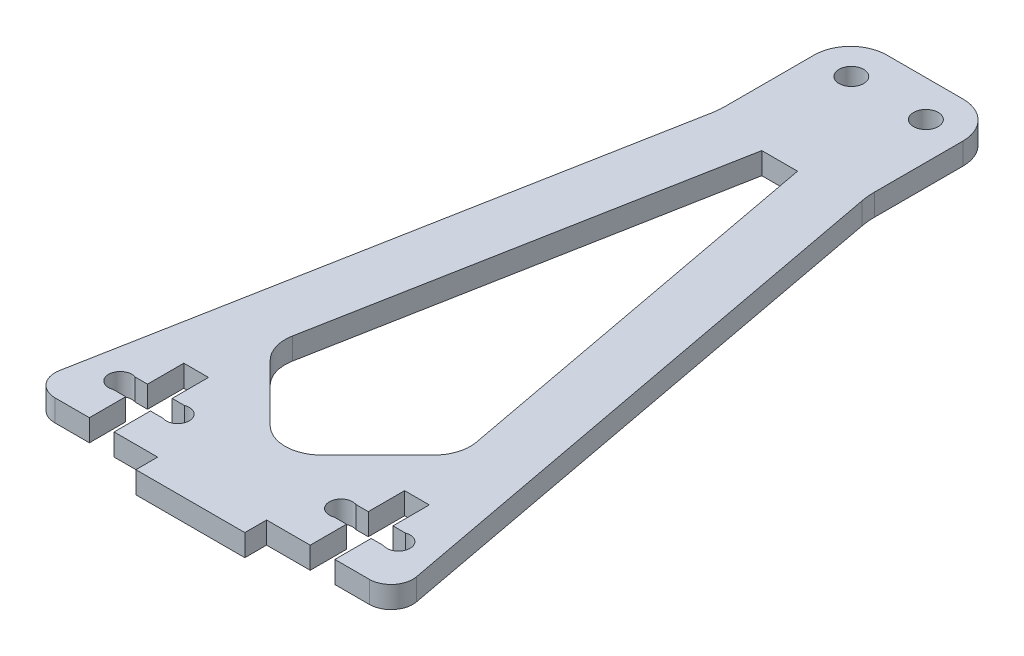
from build123d import *

# Parameters (mm, degrees)
SKETCH_1_W          = 20.5
SKETCH_1_H          = 98.14
SKETCH_1_R          = 1.7
EXTRUDE_1_DEPTH     = 3
FILLET_1_R          = 5
EXTRUDE_2_DEPTH     = 3
FILLET_2_R          = 10
SKETCH_3_W          = 15
SKETCH_3_H          = 3
EXTRUDE_3_DEPTH     = 3
CUT_EXTRUDE_1_DEPTH = 10
CUT_EXTRUDE_2_DEPTH = 10
FILLET_3_R          = 5
FILLET_4_R          = 3
CUT_EXTRUDE_3_DEPTH = 10


with BuildPart() as part:
    # 草图1 → 凸台-拉伸1 (new body)
    with BuildSketch(Plane(origin=(0, 0, 0), x_dir=(1, 0, 0), z_dir=(0, 1, 0))):
        Rectangle(SKETCH_1_W, SKETCH_1_H)
        with Locations(Location((-5.135, 44.07, 0), (0, 0, 270))):
            Circle(SKETCH_1_R, mode=Mode.SUBTRACT)
        with Locations(Location((5.135, 44.07, 0), (0, 0, 270))):
            Circle(SKETCH_1_R, mode=Mode.SUBTRACT)
    extrude(amount=EXTRUDE_1_DEPTH)

    # 圆角1
    fillet_1_edges = [part.edges().sort_by_distance(p)[0] for p in [
        (-10.25, 1.5, -49.07),
        (10.25, 1.5, -49.07),
    ]]
    fillet(fillet_1_edges, radius=FILLET_1_R)

    # 草图2 → 凸台-拉伸2 (add)
    with BuildSketch(Plane(origin=(0, 3, 0), x_dir=(1, 0, 0), z_dir=(0, 1, 0))):
        Polygon((-10.25, 30.93), (-25.25, -49.07), (-10.25, -49.07), align=None)
        Polygon((10.25, 30.93), (10.25, -49.07), (25.25, -49.07), align=None)
    extrude(amount=-EXTRUDE_2_DEPTH)

    # 圆角2
    fillet_2_edges = [part.edges().sort_by_distance(p)[0] for p in [
        (-10.25, 1.5, -30.93),
        (10.25, 1.5, -30.93),
    ]]
    fillet(fillet_2_edges, radius=FILLET_2_R)

    # 草图3 → 凸台-拉伸3 (add)
    with BuildSketch(Plane(origin=(0, 3, 0), x_dir=(1, 0, 0), z_dir=(0, 1, 0))):
        with Locations((0, -50.57)):
            Rectangle(SKETCH_3_W, SKETCH_3_H)
    extrude(amount=-EXTRUDE_3_DEPTH)

    # 草图5 → 切除-拉伸1 (cut)
    with BuildSketch(Plane(origin=(0, 3, 0), x_dir=(1, 0, 0), z_dir=(0, 1, 0))):
        Polygon((-16.9, -49.07), (-16.9, -44.07), (-18.6, -44.07), (-18.6, -41.07), (-16.9, -41.07), (-16.9, -36.07), (-13.5, -36.07), (-13.5, -41.07), (-11.8, -41.07), (-11.8, -44.07), (-13.5, -44.07), (-13.5, -49.07), align=None)
        Polygon((13.5, -49.07), (16.9, -49.07), (16.9, -44.07), (18.6, -44.07), (18.6, -41.07), (16.9, -41.07), (16.9, -36.07), (13.5, -36.07), (13.5, -41.07), (11.8, -41.07), (11.8, -44.07), (13.5, -44.07), align=None)
    extrude(amount=-CUT_EXTRUDE_1_DEPTH, mode=Mode.SUBTRACT)

    # 草图6 → 切除-拉伸2 (cut)
    with BuildSketch(Plane(origin=(0, 3, 0), x_dir=(1, 0, 0), z_dir=(0, 1, 0))):
        Polygon((-2.459339702, 29.07), (2.459339702, 29.07), (13.148083743, -27.936634883), (0, -41.084718626), (-13.148083743, -27.936634883), align=None)
    extrude(amount=-CUT_EXTRUDE_2_DEPTH, mode=Mode.SUBTRACT)

    # 圆角3
    fillet_3_edges = [part.edges().sort_by_distance(p)[0] for p in [
        (-13.148083743, 1.5, 27.936634883),
        (13.148083743, 1.5, 27.936634883),
        (0, 1.5, 41.084718626),
    ]]
    fillet(fillet_3_edges, radius=FILLET_3_R)

    # 圆角4
    fillet_4_edges = [part.edges().sort_by_distance(p)[0] for p in [
        (-25.25, 1.5, 49.07),
        (25.25, 1.5, 49.07),
    ]]
    fillet(fillet_4_edges, radius=FILLET_4_R)

    # 草图7 → 切除-拉伸3 (cut)
    with BuildSketch(Plane.XZ):
        with BuildLine():
            Line((-18.6, 44.07), (-18.6, 41.07))
            ThreePointArc((-18.6, 41.07), (-20.756776436, 42.57), (-18.6, 44.07))
        make_face()
        with BuildLine():
            Line((-11.8, 44.07), (-11.8, 41.07))
            ThreePointArc((-11.8, 41.07), (-9.643223564, 42.57), (-11.8, 44.07))
        make_face()
        with BuildLine():
            Line((11.8, 44.07), (11.8, 41.07))
            ThreePointArc((11.8, 41.07), (9.643223564, 42.57), (11.8, 44.07))
        make_face()
        with BuildLine():
            Line((18.6, 44.07), (18.6, 41.07))
            ThreePointArc((18.6, 41.07), (20.756776436, 42.57), (18.6, 44.07))
        make_face()
    extrude(amount=-CUT_EXTRUDE_3_DEPTH, mode=Mode.SUBTRACT)


solid = part.part
